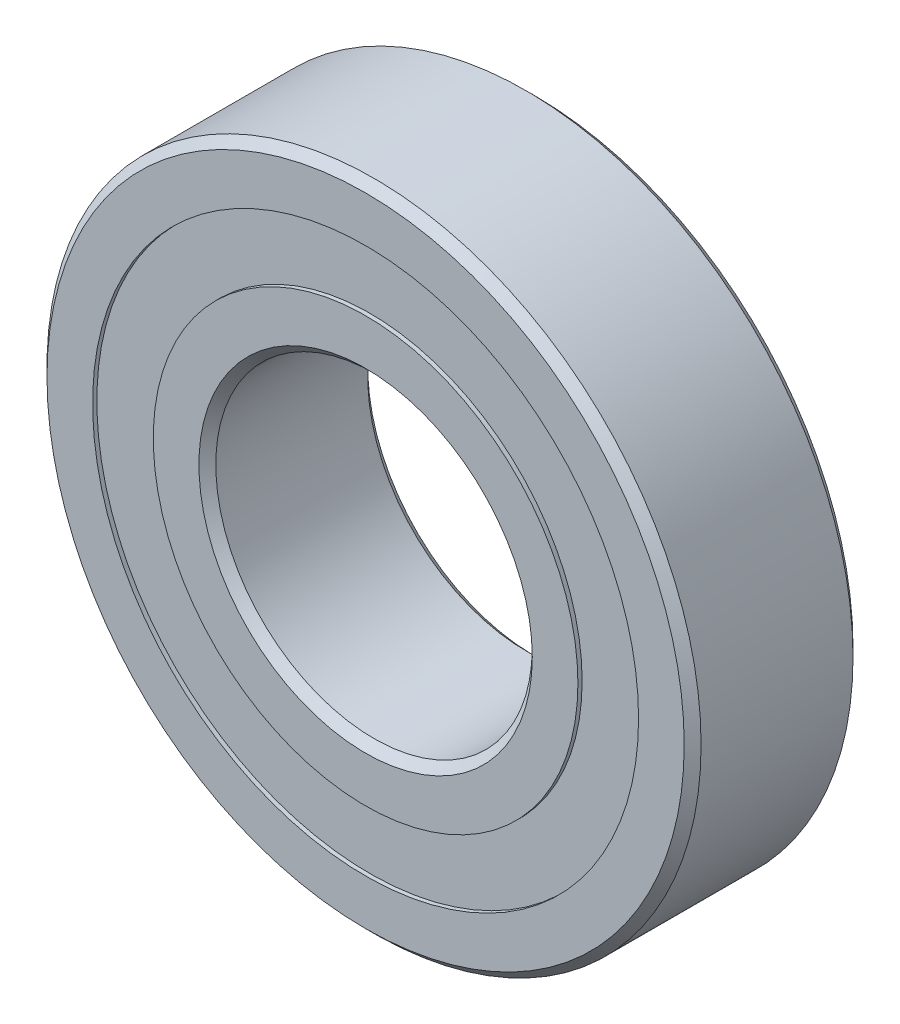
from build123d import *

# Parameters (mm, degrees)
CIRPATTERN1_COUNT = 11
SKETCH5_W         = 3.027517052
SKETCH5_H         = 5.75


with BuildPart() as part:
    # Sketch3 → Revolve1 (revolve)
    with BuildSketch(Plane(origin=(0, 0, 0), x_dir=(0, 0, -1), z_dir=(1, 0, 0)), mode=Mode.PRIVATE) as revolve1_sk:
        with BuildLine():
            Line((-8, 30.2), (-8, 25.875))
            Line((-8, 25.875), (-3.555555556, 25.875))
            ThreePointArc((-3.555555556, 25.875), (0, 27.572482948), (3.555555556, 25.875))
            Line((3.555555556, 25.875), (8, 25.875))
            Line((8, 25.875), (8, 30.2))
            Line((8, 30.2), (7.2, 31))
            Line((7.2, 31), (-7.2, 31))
            Line((-7.2, 31), (-8, 30.2))
        make_face()
        with BuildLine():
            Line((-8, 15.8), (-8, 20.125))
            Line((-8, 20.125), (-3.555555556, 20.125))
            ThreePointArc((-3.555555556, 20.125), (0, 18.427517052), (3.555555556, 20.125))
            Line((3.555555556, 20.125), (8, 20.125))
            Line((8, 20.125), (8, 15.8))
            Line((8, 15.8), (7.2, 15))
            Line((7.2, 15), (-7.2, 15))
            Line((-7.2, 15), (-8, 15.8))
        make_face()
    revolve(revolve1_sk.sketch.rotate(Axis((0, 0, 8), (0, 0, -1)), 90), axis=Axis((0, 0, 8), (0, 0, -1)))


with BuildPart() as body_2:
    # Sketch4 → Revolve2 (revolve)
    with BuildSketch(Plane(origin=(0, 0, 0), x_dir=(0, 0, -1), z_dir=(1, 0, 0))):
        with BuildLine():
            Line((-4.572482948, 23), (4.572482948, 23))
            ThreePointArc((4.572482948, 23), (0, 27.572482948), (-4.572482948, 23))
        make_face()
    revolve(axis=Axis((0, 23, 4.572482948), (0, 0, -1)))


with BuildPart() as cirpattern1_1:
    # CirPattern1: pattern copy
    add(body_2.part.rotate(Axis((0, 0, 0), (0, 0, 1)), 1 * 360 / CIRPATTERN1_COUNT))


with BuildPart() as cirpattern1_2:
    # CirPattern1: pattern copy
    add(body_2.part.rotate(Axis((0, 0, 0), (0, 0, 1)), 2 * 360 / CIRPATTERN1_COUNT))


with BuildPart() as cirpattern1_3:
    # CirPattern1: pattern copy
    add(body_2.part.rotate(Axis((0, 0, 0), (0, 0, 1)), 3 * 360 / CIRPATTERN1_COUNT))


with BuildPart() as cirpattern1_4:
    # CirPattern1: pattern copy
    add(body_2.part.rotate(Axis((0, 0, 0), (0, 0, 1)), 4 * 360 / CIRPATTERN1_COUNT))


with BuildPart() as cirpattern1_5:
    # CirPattern1: pattern copy
    add(body_2.part.rotate(Axis((0, 0, 0), (0, 0, 1)), 5 * 360 / CIRPATTERN1_COUNT))


with BuildPart() as cirpattern1_6:
    # CirPattern1: pattern copy
    add(body_2.part.rotate(Axis((0, 0, 0), (0, 0, 1)), 6 * 360 / CIRPATTERN1_COUNT))


with BuildPart() as cirpattern1_7:
    # CirPattern1: pattern copy
    add(body_2.part.rotate(Axis((0, 0, 0), (0, 0, 1)), 7 * 360 / CIRPATTERN1_COUNT))


with BuildPart() as cirpattern1_8:
    # CirPattern1: pattern copy
    add(body_2.part.rotate(Axis((0, 0, 0), (0, 0, 1)), 8 * 360 / CIRPATTERN1_COUNT))


with BuildPart() as cirpattern1_9:
    # CirPattern1: pattern copy
    add(body_2.part.rotate(Axis((0, 0, 0), (0, 0, 1)), 9 * 360 / CIRPATTERN1_COUNT))


with BuildPart() as cirpattern1_10:
    # CirPattern1: pattern copy
    add(body_2.part.rotate(Axis((0, 0, 0), (0, 0, 1)), 10 * 360 / CIRPATTERN1_COUNT))


with BuildPart() as body_13:
    # Sketch5 → Revolve3 (revolve)
    with BuildSketch(Plane(origin=(0, 0, 0), x_dir=(0, 0, -1), z_dir=(1, 0, 0)), mode=Mode.PRIVATE) as revolve3_sk:
        with Locations((-6.086241474, 23)):
            Rectangle(SKETCH5_W, SKETCH5_H)
        with Locations((6.086241474, 23)):
            Rectangle(SKETCH5_W, SKETCH5_H)
    revolve(revolve3_sk.sketch.rotate(Axis((0, 0, 8), (0, 0, -1)), 90), axis=Axis((0, 0, 8), (0, 0, -1)))


solid = Compound([part.part, body_2.part, cirpattern1_1.part, cirpattern1_2.part, cirpattern1_3.part, cirpattern1_4.part, cirpattern1_5.part, cirpattern1_6.part, cirpattern1_7.part, cirpattern1_8.part, cirpattern1_9.part, cirpattern1_10.part, body_13.part])
